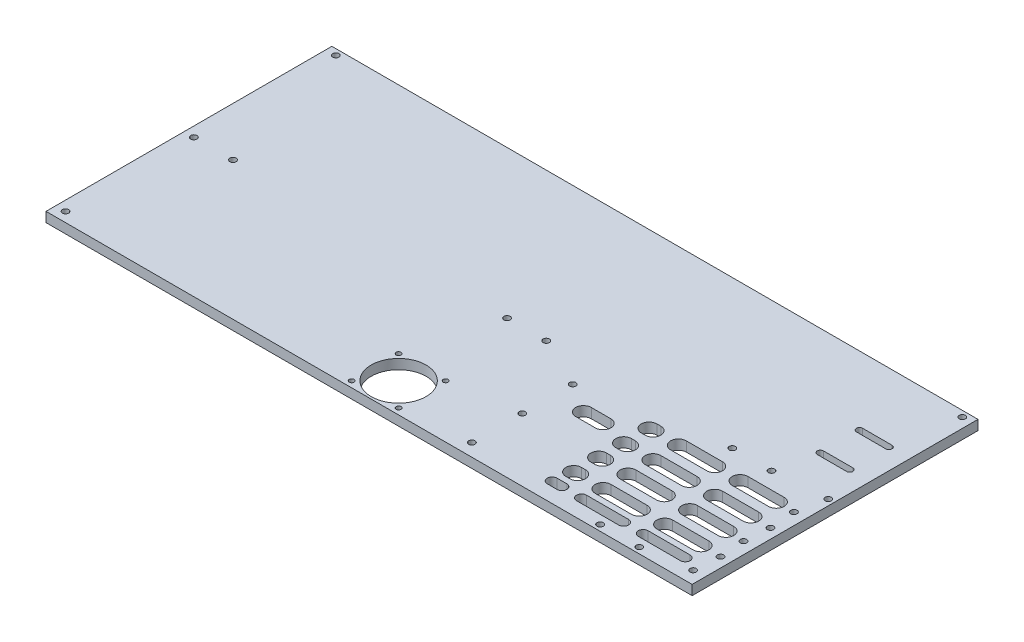
from build123d import *

# Parameters (mm, degrees)
SKETCH_1_W          = 330
SKETCH_1_H          = 146
EXTRUDE_1_DEPTH     = 5
SKETCH_2_R          = 1.6
CUT_EXTRUDE_1_DEPTH = 361.889179666
SKETCH_3_R          = 1.6
CUT_EXTRUDE_2_DEPTH = 361.889179666
CUT_EXTRUDE_3_REACH = 362.889
SKETCH_5_R          = 1.6
CUT_EXTRUDE_4_REACH = 362.889
SKETCH_7_R          = 14
SKETCH_7_R_2        = 1.25
CUT_EXTRUDE_5_DEPTH = 10


with BuildPart() as part:
    # 草图1 → 凸台-拉伸1 (new body)
    with BuildSketch(Plane(origin=(0, 0, 0), x_dir=(1, 0, 0), z_dir=(0, 1, 0))):
        with Locations((165, 73)):
            Rectangle(SKETCH_1_W, SKETCH_1_H)
    extrude(amount=EXTRUDE_1_DEPTH)

    # 草图2 → 切除-拉伸1 (cut, through all)
    with BuildSketch(Plane(origin=(0, 5, 0), x_dir=(1, 0, 0), z_dir=(0, 1, 0))):
        with Locations(Location((5, 70.5, 0), (0, 0, 270))):
            Circle(SKETCH_2_R)
        with Locations(Location((25, 70.5, 0), (0, 0, 270))):
            Circle(SKETCH_2_R)
        with Locations(Location((165, 70.5, 0), (0, 0, 270))):
            Circle(SKETCH_2_R)
        with Locations(Location((185, 70.5, 0), (0, 0, 270))):
            Circle(SKETCH_2_R)
        with Locations(Location((280, 3, 0), (0, 0, 270))):
            Circle(SKETCH_2_R)
        with Locations(Location((300, 3, 0), (0, 0, 270))):
            Circle(SKETCH_2_R)
        with Locations(Location((280, 70.5, 0), (0, 0, 270))):
            Circle(SKETCH_2_R)
        with Locations(Location((300, 70.5, 0), (0, 0, 270))):
            Circle(SKETCH_2_R)
        with BuildLine():
            Line((304.5, 112.6), (319.5, 112.6))
            ThreePointArc((319.5, 112.6), (321.1, 111), (319.5, 109.4))
            Line((319.5, 109.4), (304.5, 109.4))
            ThreePointArc((304.5, 109.4), (302.9, 111), (304.5, 112.6))
        make_face()
        with BuildLine():
            Line((304.5, 92.6), (319.5, 92.6))
            ThreePointArc((319.5, 92.6), (321.1, 91), (319.5, 89.4))
            Line((319.5, 89.4), (304.5, 89.4))
            ThreePointArc((304.5, 89.4), (302.9, 91), (304.5, 92.6))
        make_face()
    extrude(amount=-CUT_EXTRUDE_1_DEPTH, mode=Mode.SUBTRACT)

    # 草图3 → 切除-拉伸2 (cut, through all)
    with BuildSketch(Plane(origin=(0, 5, 0), x_dir=(1, 0, 0), z_dir=(0, 1, 0))):
        with Locations(Location((211, 58, 0), (0, 0, 270))):
            Circle(SKETCH_3_R)
        with Locations(Location((324, 58, 0), (0, 0, 270))):
            Circle(SKETCH_3_R)
        with Locations(Location((324, 32.25, 0), (0, 0, 270))):
            Circle(SKETCH_3_R)
        with Locations(Location((211, 32.25, 0), (0, 0, 270))):
            Circle(SKETCH_3_R)
        with Locations(Location((211, 6.5, 0), (0, 0, 270))):
            Circle(SKETCH_3_R)
        with Locations(Location((324, 6.5, 0), (0, 0, 270))):
            Circle(SKETCH_3_R)
    extrude(amount=-CUT_EXTRUDE_2_DEPTH, mode=Mode.SUBTRACT)

    # 草图5 → 切除-拉伸3 (cut, up to next)
    with BuildSketch(Plane(origin=(0, 5, 0), x_dir=(1, 0, 0), z_dir=(0, 1, 0)), mode=Mode.PRIVATE) as cut_extrude_3_sk1:
        with Locations(Location((325, 19.5, 0), (0, 0, 270))):
            Circle(SKETCH_5_R)
    cut_extrude_3_tool1 = extrude(cut_extrude_3_sk1.sketch, amount=-CUT_EXTRUDE_3_REACH, mode=Mode.PRIVATE) & part.part
    # 草图5 → 切除-拉伸3 (cut, up to next)
    with BuildSketch(Plane(origin=(0, 5, 0), x_dir=(1, 0, 0), z_dir=(0, 1, 0)), mode=Mode.PRIVATE) as cut_extrude_3_sk2:
        with Locations(Location((325, 45, 0), (0, 0, 270))):
            Circle(SKETCH_5_R)
    cut_extrude_3_tool2 = extrude(cut_extrude_3_sk2.sketch, amount=-CUT_EXTRUDE_3_REACH, mode=Mode.PRIVATE) & part.part
    # 草图5 → 切除-拉伸3 (cut, up to next)
    with BuildSketch(Plane(origin=(0, 5, 0), x_dir=(1, 0, 0), z_dir=(0, 1, 0)), mode=Mode.PRIVATE) as cut_extrude_3_sk3:
        with Locations(Location((327, 72.5, 0), (0, 0, 270))):
            Circle(SKETCH_5_R)
    cut_extrude_3_tool3 = extrude(cut_extrude_3_sk3.sketch, amount=-CUT_EXTRUDE_3_REACH, mode=Mode.PRIVATE) & part.part
    # 草图5 → 切除-拉伸3 (cut, up to next)
    with BuildSketch(Plane(origin=(0, 5, 0), x_dir=(1, 0, 0), z_dir=(0, 1, 0)), mode=Mode.PRIVATE) as cut_extrude_3_sk4:
        with Locations(Location((325, 143, 0), (0, 0, 270))):
            Circle(SKETCH_5_R)
    cut_extrude_3_tool4 = extrude(cut_extrude_3_sk4.sketch, amount=-CUT_EXTRUDE_3_REACH, mode=Mode.PRIVATE) & part.part
    # 草图5 → 切除-拉伸3 (cut, up to next)
    with BuildSketch(Plane(origin=(0, 5, 0), x_dir=(1, 0, 0), z_dir=(0, 1, 0)), mode=Mode.PRIVATE) as cut_extrude_3_sk5:
        with Locations(Location((5, 143, 0), (0, 0, 270))):
            Circle(SKETCH_5_R)
    cut_extrude_3_tool5 = extrude(cut_extrude_3_sk5.sketch, amount=-CUT_EXTRUDE_3_REACH, mode=Mode.PRIVATE) & part.part
    # 草图5 → 切除-拉伸3 (cut, up to next)
    with BuildSketch(Plane(origin=(0, 5, 0), x_dir=(1, 0, 0), z_dir=(0, 1, 0)), mode=Mode.PRIVATE) as cut_extrude_3_sk6:
        with Locations(Location((5, 5, 0), (0, 0, 270))):
            Circle(SKETCH_5_R)
    cut_extrude_3_tool6 = extrude(cut_extrude_3_sk6.sketch, amount=-CUT_EXTRUDE_3_REACH, mode=Mode.PRIVATE) & part.part
    add(cut_extrude_3_tool1.solids().sort_by_distance((325, 5, -19.5))[0], mode=Mode.SUBTRACT)
    add(cut_extrude_3_tool2.solids().sort_by_distance((325, 5, -45))[0], mode=Mode.SUBTRACT)
    add(cut_extrude_3_tool3.solids().sort_by_distance((327, 5, -72.5))[0], mode=Mode.SUBTRACT)
    add(cut_extrude_3_tool4.solids().sort_by_distance((325, 5, -143))[0], mode=Mode.SUBTRACT)
    add(cut_extrude_3_tool5.solids().sort_by_distance((5, 5, -143))[0], mode=Mode.SUBTRACT)
    add(cut_extrude_3_tool6.solids().sort_by_distance((5, 5, -5))[0], mode=Mode.SUBTRACT)

    # 草图6 → 切除-拉伸4 (cut, up to next)
    with BuildSketch(Plane(origin=(0, 5, 0), x_dir=(1, 0, 0), z_dir=(0, 1, 0)), mode=Mode.PRIVATE) as cut_extrude_4_sk1:
        with BuildLine():
            Line((296.5, 62), (315, 62))
            ThreePointArc((315, 62), (319, 58), (315, 54))
            Line((315, 54), (296.5, 54))
            ThreePointArc((296.5, 54), (292.5, 58), (296.5, 62))
        make_face()
    cut_extrude_4_tool1 = extrude(cut_extrude_4_sk1.sketch, amount=-CUT_EXTRUDE_4_REACH, mode=Mode.PRIVATE) & part.part
    # 草图6 → 切除-拉伸4 (cut, up to next)
    with BuildSketch(Plane(origin=(0, 5, 0), x_dir=(1, 0, 0), z_dir=(0, 1, 0)), mode=Mode.PRIVATE) as cut_extrude_4_sk2:
        with BuildLine():
            Line((315, 41), (296.5, 41))
            ThreePointArc((296.5, 41), (292.5, 45), (296.5, 49))
            Line((296.5, 49), (315, 49))
            ThreePointArc((315, 49), (319, 45), (315, 41))
        make_face()
    cut_extrude_4_tool2 = extrude(cut_extrude_4_sk2.sketch, amount=-CUT_EXTRUDE_4_REACH, mode=Mode.PRIVATE) & part.part
    # 草图6 → 切除-拉伸4 (cut, up to next)
    with BuildSketch(Plane(origin=(0, 5, 0), x_dir=(1, 0, 0), z_dir=(0, 1, 0)), mode=Mode.PRIVATE) as cut_extrude_4_sk3:
        with BuildLine():
            Line((296.5, 36.25), (315, 36.25))
            ThreePointArc((315, 36.25), (319, 32.25), (315, 28.25))
            Line((315, 28.25), (296.5, 28.25))
            ThreePointArc((296.5, 28.25), (292.5, 32.25), (296.5, 36.25))
        make_face()
    cut_extrude_4_tool3 = extrude(cut_extrude_4_sk3.sketch, amount=-CUT_EXTRUDE_4_REACH, mode=Mode.PRIVATE) & part.part
    # 草图6 → 切除-拉伸4 (cut, up to next)
    with BuildSketch(Plane(origin=(0, 5, 0), x_dir=(1, 0, 0), z_dir=(0, 1, 0)), mode=Mode.PRIVATE) as cut_extrude_4_sk4:
        with BuildLine():
            Line((296.5, 23.5), (315, 23.5))
            ThreePointArc((315, 23.5), (319, 19.5), (315, 15.5))
            Line((315, 15.5), (296.5, 15.5))
            ThreePointArc((296.5, 15.5), (292.5, 19.5), (296.5, 23.5))
        make_face()
    cut_extrude_4_tool4 = extrude(cut_extrude_4_sk4.sketch, amount=-CUT_EXTRUDE_4_REACH, mode=Mode.PRIVATE) & part.part
    # 草图6 → 切除-拉伸4 (cut, up to next)
    with BuildSketch(Plane(origin=(0, 5, 0), x_dir=(1, 0, 0), z_dir=(0, 1, 0)), mode=Mode.PRIVATE) as cut_extrude_4_sk5:
        with BuildLine():
            Line((283.5, 23.5), (265, 23.5))
            ThreePointArc((265, 23.5), (261, 19.5), (265, 15.5))
            Line((265, 15.5), (283.5, 15.5))
            ThreePointArc((283.5, 15.5), (287.5, 19.5), (283.5, 23.5))
        make_face()
    cut_extrude_4_tool5 = extrude(cut_extrude_4_sk5.sketch, amount=-CUT_EXTRUDE_4_REACH, mode=Mode.PRIVATE) & part.part
    # 草图6 → 切除-拉伸4 (cut, up to next)
    with BuildSketch(Plane(origin=(0, 5, 0), x_dir=(1, 0, 0), z_dir=(0, 1, 0)), mode=Mode.PRIVATE) as cut_extrude_4_sk6:
        with BuildLine():
            Line((283.5, 36.25), (265, 36.25))
            ThreePointArc((265, 36.25), (261, 32.25), (265, 28.25))
            Line((265, 28.25), (283.5, 28.25))
            ThreePointArc((283.5, 28.25), (287.5, 32.25), (283.5, 36.25))
        make_face()
    cut_extrude_4_tool6 = extrude(cut_extrude_4_sk6.sketch, amount=-CUT_EXTRUDE_4_REACH, mode=Mode.PRIVATE) & part.part
    # 草图6 → 切除-拉伸4 (cut, up to next)
    with BuildSketch(Plane(origin=(0, 5, 0), x_dir=(1, 0, 0), z_dir=(0, 1, 0)), mode=Mode.PRIVATE) as cut_extrude_4_sk7:
        with BuildLine():
            Line((265, 41), (283.5, 41))
            ThreePointArc((283.5, 41), (287.5, 45), (283.5, 49))
            Line((283.5, 49), (265, 49))
            ThreePointArc((265, 49), (261, 45), (265, 41))
        make_face()
    cut_extrude_4_tool7 = extrude(cut_extrude_4_sk7.sketch, amount=-CUT_EXTRUDE_4_REACH, mode=Mode.PRIVATE) & part.part
    # 草图6 → 切除-拉伸4 (cut, up to next)
    with BuildSketch(Plane(origin=(0, 5, 0), x_dir=(1, 0, 0), z_dir=(0, 1, 0)), mode=Mode.PRIVATE) as cut_extrude_4_sk8:
        with BuildLine():
            Line((283.5, 62), (265, 62))
            ThreePointArc((265, 62), (261, 58), (265, 54))
            Line((265, 54), (283.5, 54))
            ThreePointArc((283.5, 54), (287.5, 58), (283.5, 62))
        make_face()
    cut_extrude_4_tool8 = extrude(cut_extrude_4_sk8.sketch, amount=-CUT_EXTRUDE_4_REACH, mode=Mode.PRIVATE) & part.part
    # 草图6 → 切除-拉伸4 (cut, up to next)
    with BuildSketch(Plane(origin=(0, 5, 0), x_dir=(1, 0, 0), z_dir=(0, 1, 0)), mode=Mode.PRIVATE) as cut_extrude_4_sk9:
        with BuildLine():
            Line((295, 12.5), (316.5, 12.5))
            ThreePointArc((316.5, 12.5), (319, 10), (316.5, 7.5))
            Line((316.5, 7.5), (295, 7.5))
            ThreePointArc((295, 7.5), (292.5, 10), (295, 12.5))
        make_face()
    cut_extrude_4_tool9 = extrude(cut_extrude_4_sk9.sketch, amount=-CUT_EXTRUDE_4_REACH, mode=Mode.PRIVATE) & part.part
    # 草图6 → 切除-拉伸4 (cut, up to next)
    with BuildSketch(Plane(origin=(0, 5, 0), x_dir=(1, 0, 0), z_dir=(0, 1, 0)), mode=Mode.PRIVATE) as cut_extrude_4_sk10:
        with BuildLine():
            Line((285, 12.5), (263.5, 12.5))
            ThreePointArc((263.5, 12.5), (261, 10), (263.5, 7.5))
            Line((263.5, 7.5), (285, 7.5))
            ThreePointArc((285, 7.5), (287.5, 10), (285, 12.5))
        make_face()
    cut_extrude_4_tool10 = extrude(cut_extrude_4_sk10.sketch, amount=-CUT_EXTRUDE_4_REACH, mode=Mode.PRIVATE) & part.part
    # 草图6 → 切除-拉伸4 (cut, up to next)
    with BuildSketch(Plane(origin=(0, 5, 0), x_dir=(1, 0, 0), z_dir=(0, 1, 0)), mode=Mode.PRIVATE) as cut_extrude_4_sk11:
        with BuildLine():
            Line((250, 62), (252, 62))
            ThreePointArc((252, 62), (256, 58), (252, 54))
            Line((252, 54), (250, 54))
            ThreePointArc((250, 54), (246, 58), (250, 62))
        make_face()
    cut_extrude_4_tool11 = extrude(cut_extrude_4_sk11.sketch, amount=-CUT_EXTRUDE_4_REACH, mode=Mode.PRIVATE) & part.part
    # 草图6 → 切除-拉伸4 (cut, up to next)
    with BuildSketch(Plane(origin=(0, 5, 0), x_dir=(1, 0, 0), z_dir=(0, 1, 0)), mode=Mode.PRIVATE) as cut_extrude_4_sk12:
        with BuildLine():
            Line((250, 49), (252, 49))
            ThreePointArc((252, 49), (256, 45), (252, 41))
            Line((252, 41), (250, 41))
            ThreePointArc((250, 41), (246, 45), (250, 49))
        make_face()
    cut_extrude_4_tool12 = extrude(cut_extrude_4_sk12.sketch, amount=-CUT_EXTRUDE_4_REACH, mode=Mode.PRIVATE) & part.part
    # 草图6 → 切除-拉伸4 (cut, up to next)
    with BuildSketch(Plane(origin=(0, 5, 0), x_dir=(1, 0, 0), z_dir=(0, 1, 0)), mode=Mode.PRIVATE) as cut_extrude_4_sk13:
        with BuildLine():
            Line((250, 36.25), (252, 36.25))
            ThreePointArc((252, 36.25), (256, 32.25), (252, 28.25))
            Line((252, 28.25), (250, 28.25))
            ThreePointArc((250, 28.25), (246, 32.25), (250, 36.25))
        make_face()
    cut_extrude_4_tool13 = extrude(cut_extrude_4_sk13.sketch, amount=-CUT_EXTRUDE_4_REACH, mode=Mode.PRIVATE) & part.part
    # 草图6 → 切除-拉伸4 (cut, up to next)
    with BuildSketch(Plane(origin=(0, 5, 0), x_dir=(1, 0, 0), z_dir=(0, 1, 0)), mode=Mode.PRIVATE) as cut_extrude_4_sk14:
        with BuildLine():
            Line((250, 23.5), (252, 23.5))
            ThreePointArc((252, 23.5), (256, 19.5), (252, 15.5))
            Line((252, 15.5), (250, 15.5))
            ThreePointArc((250, 15.5), (246, 19.5), (250, 23.5))
        make_face()
    cut_extrude_4_tool14 = extrude(cut_extrude_4_sk14.sketch, amount=-CUT_EXTRUDE_4_REACH, mode=Mode.PRIVATE) & part.part
    # 草图6 → 切除-拉伸4 (cut, up to next)
    with BuildSketch(Plane(origin=(0, 5, 0), x_dir=(1, 0, 0), z_dir=(0, 1, 0)), mode=Mode.PRIVATE) as cut_extrude_4_sk15:
        with BuildLine():
            Line((248.5, 12.5), (253.5, 12.5))
            ThreePointArc((253.5, 12.5), (256, 10), (253.5, 7.5))
            Line((253.5, 7.5), (248.5, 7.5))
            ThreePointArc((248.5, 7.5), (246, 10), (248.5, 12.5))
        make_face()
    cut_extrude_4_tool15 = extrude(cut_extrude_4_sk15.sketch, amount=-CUT_EXTRUDE_4_REACH, mode=Mode.PRIVATE) & part.part
    # 草图6 → 切除-拉伸4 (cut, up to next)
    with BuildSketch(Plane(origin=(0, 5, 0), x_dir=(1, 0, 0), z_dir=(0, 1, 0)), mode=Mode.PRIVATE) as cut_extrude_4_sk16:
        with BuildLine():
            Line((226, 52.5), (236, 52.5))
            ThreePointArc((236, 52.5), (240, 48.5), (236, 44.5))
            Line((236, 44.5), (226, 44.5))
            ThreePointArc((226, 44.5), (222, 48.5), (226, 52.5))
        make_face()
    cut_extrude_4_tool16 = extrude(cut_extrude_4_sk16.sketch, amount=-CUT_EXTRUDE_4_REACH, mode=Mode.PRIVATE) & part.part
    add(cut_extrude_4_tool1.solids().sort_by_distance((305.75, 5, -58))[0], mode=Mode.SUBTRACT)
    add(cut_extrude_4_tool2.solids().sort_by_distance((305.75, 5, -45))[0], mode=Mode.SUBTRACT)
    add(cut_extrude_4_tool3.solids().sort_by_distance((305.75, 5, -32.25))[0], mode=Mode.SUBTRACT)
    add(cut_extrude_4_tool4.solids().sort_by_distance((305.75, 5, -19.5))[0], mode=Mode.SUBTRACT)
    add(cut_extrude_4_tool5.solids().sort_by_distance((274.25, 5, -19.5))[0], mode=Mode.SUBTRACT)
    add(cut_extrude_4_tool6.solids().sort_by_distance((274.25, 5, -32.25))[0], mode=Mode.SUBTRACT)
    add(cut_extrude_4_tool7.solids().sort_by_distance((274.25, 5, -45))[0], mode=Mode.SUBTRACT)
    add(cut_extrude_4_tool8.solids().sort_by_distance((274.25, 5, -58))[0], mode=Mode.SUBTRACT)
    add(cut_extrude_4_tool9.solids().sort_by_distance((305.75, 5, -10))[0], mode=Mode.SUBTRACT)
    add(cut_extrude_4_tool10.solids().sort_by_distance((274.25, 5, -10))[0], mode=Mode.SUBTRACT)
    add(cut_extrude_4_tool11.solids().sort_by_distance((251, 5, -58))[0], mode=Mode.SUBTRACT)
    add(cut_extrude_4_tool12.solids().sort_by_distance((251, 5, -45))[0], mode=Mode.SUBTRACT)
    add(cut_extrude_4_tool13.solids().sort_by_distance((251, 5, -32.25))[0], mode=Mode.SUBTRACT)
    add(cut_extrude_4_tool14.solids().sort_by_distance((251, 5, -19.5))[0], mode=Mode.SUBTRACT)
    add(cut_extrude_4_tool15.solids().sort_by_distance((251, 5, -10))[0], mode=Mode.SUBTRACT)
    add(cut_extrude_4_tool16.solids().sort_by_distance((231, 5, -48.5))[0], mode=Mode.SUBTRACT)

    # 草图7 → 切除-拉伸5 (cut)
    with BuildSketch(Plane(origin=(0, 5, 0), x_dir=(1, 0, 0), z_dir=(0, 1, 0))):
        with Locations(Location((165, 15.1, 0), (0, 0, 270))):
            Circle(SKETCH_7_R)
        with Locations(Location((153, 27.1, 0), (0, 0, 270))):
            Circle(SKETCH_7_R_2)
        with Locations(Location((177, 27.1, 0), (0, 0, 270))):
            Circle(SKETCH_7_R_2)
        with Locations(Location((177, 3.1, 0), (0, 0, 270))):
            Circle(SKETCH_7_R_2)
        with Locations(Location((153, 3.1, 0), (0, 0, 270))):
            Circle(SKETCH_7_R_2)
    extrude(amount=-CUT_EXTRUDE_5_DEPTH, mode=Mode.SUBTRACT)


solid = part.part
